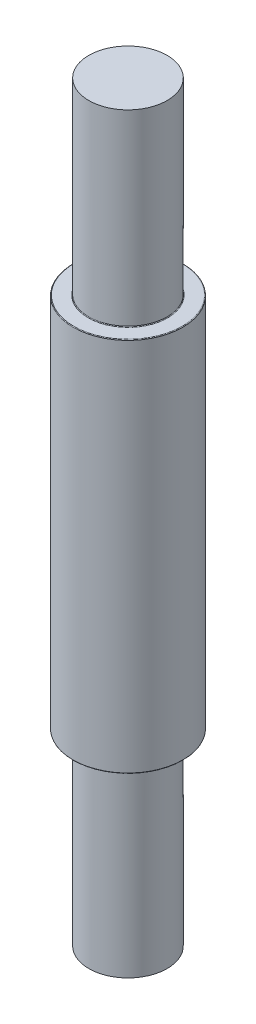
from build123d import *

# Parameters (mm, degrees)
SKETCH1_R           = 15.875
BOSS_EXTRUDE1_DEPTH = 76.2
SKETCH2_R           = 22.225
BOSS_EXTRUDE2_DEPTH = 152.4
SKETCH3_R           = 15.875
BOSS_EXTRUDE3_DEPTH = 76.2
FILLET1_R           = 0.254
FILLET2_R           = 0.254
FILLET3_R           = 0.254
FILLET4_R           = 0.254


with BuildPart() as part:
    # Sketch1 → Boss-Extrude1 (new body)
    with BuildSketch(Plane(origin=(0, 0, 0), x_dir=(1, 0, 0), z_dir=(0, 1, 0))):
        with Locations(Location((0, 0, 0), (0, 0, 90))):
            Circle(SKETCH1_R)
    extrude(amount=BOSS_EXTRUDE1_DEPTH)

    # Sketch2 → Boss-Extrude2 (add)
    with BuildSketch(Plane(origin=(0, 76.2, 0), x_dir=(1, 0, 0), z_dir=(0, 1, 0))):
        with Locations(Location((0, 0, 0), (0, 0, 90))):
            Circle(SKETCH2_R)
    extrude(amount=BOSS_EXTRUDE2_DEPTH)

    # Sketch3 → Boss-Extrude3 (add)
    with BuildSketch(Plane(origin=(0, 228.6, 0), x_dir=(1, 0, 0), z_dir=(0, 1, 0))):
        with Locations(Location((0, 0, 0), (0, 0, 90))):
            Circle(SKETCH3_R)
    extrude(amount=BOSS_EXTRUDE3_DEPTH)

    # Fillet1
    fillet1_edges = [part.edges().sort_by_distance(p)[0] for p in [
        (0, 76.2, 15.875),
    ]]
    fillet(fillet1_edges, radius=FILLET1_R)

    # Fillet2
    fillet2_edges = [part.edges().sort_by_distance(p)[0] for p in [
        (0, 228.6, 15.875),
    ]]
    fillet(fillet2_edges, radius=FILLET2_R)

    # Fillet3
    fillet3_edges = [part.edges().sort_by_distance(p)[0] for p in [
        (0, 228.6, 22.225),
    ]]
    fillet(fillet3_edges, radius=FILLET3_R)

    # Fillet4
    fillet4_edges = [part.edges().sort_by_distance(p)[0] for p in [
        (0, 76.2, 22.225),
    ]]
    fillet(fillet4_edges, radius=FILLET4_R)


solid = part.part
